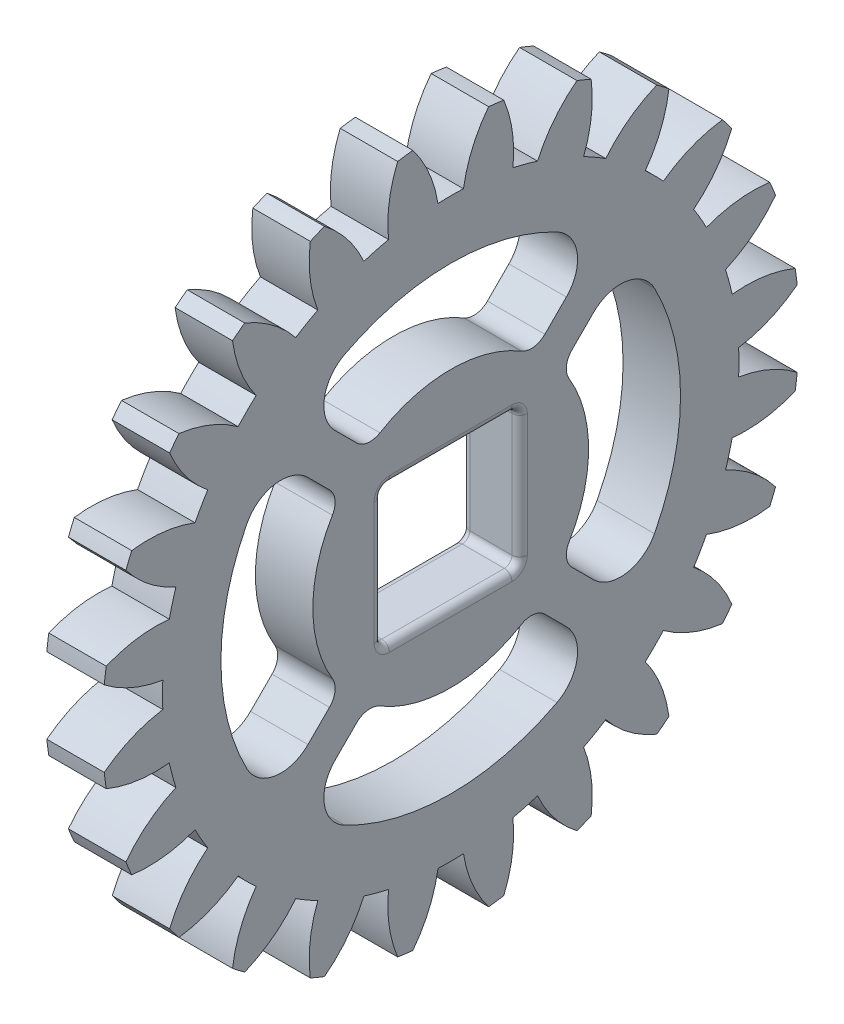
from build123d import *

# Parameters (mm, degrees)
BASPROSKE_W        = 15
BASPROSKE_H        = 91
TOOTHCUT_DEPTH     = 130.564655674
TEETHCUTS_COUNT    = 24
TEETHCUTS_ANGLE    = 345
BORSKE_R           = 12.5
BORE_DEPTH         = 50.0000508
SKETCH1_W          = 36
SKETCH1_H          = 36
CUT_EXTRUDE1_DEPTH = 129.807107813
FILLET1_R          = 2
CUT_EXTRUDE2_DEPTH = 129.807107813
FILLET2_R          = 5
FILLET3_R          = 10


with BuildPart() as part:
    # BasProSke → Base-Revolve (revolve)
    with BuildSketch(Plane(origin=(0, 0, 0), x_dir=(1, 0, 0), z_dir=(0, 1, 0)), mode=Mode.PRIVATE) as base_revolve_sk:
        with Locations((7.5, 45.5)):
            Rectangle(BASPROSKE_W, BASPROSKE_H)
    revolve(base_revolve_sk.sketch.rotate(Axis((-10, 0, 0), (1, 0, 0)), 180), axis=Axis((-10, 0, 0), (1, 0, 0)))

    # TooCutSke → ToothCut (cut, through all)
    with BuildSketch(Plane(origin=(0, 0, 0), x_dir=(0, 0, -1), z_dir=(1, 0, 0))):
        with BuildLine():
            ThreePointArc((3.330162782, 75.175275303), (0, 75.249), (-3.330162782, 75.175275303))
            ThreePointArc((-3.330162782, 75.175275303), (-5.65639011, 83.244180048), (-9.91079158, 90.48425087))
            ThreePointArc((-9.91079158, 90.48425087), (0, 91.0254), (9.91079158, 90.48425087))
            ThreePointArc((9.91079158, 90.48425087), (5.65639011, 83.244180048), (3.330162782, 75.175275303))
        make_face()
    toothcut = extrude(amount=TOOTHCUT_DEPTH, mode=Mode.SUBTRACT)

    # TeethCuts: ToothCut ×24 about axis
    teethcuts_axis = Axis((-10, 0, 0), (1, 0, 0))
    for i in range(1, TEETHCUTS_COUNT):
        add(toothcut.rotate(teethcuts_axis, i * TEETHCUTS_ANGLE / (TEETHCUTS_COUNT - 1)), mode=Mode.SUBTRACT)

    # BorSke → Bore (cut, symmetric)
    with BuildSketch(Plane(origin=(0, 0, 0), x_dir=(0, 0, -1), z_dir=(1, 0, 0))):
        with Locations(Location((0, 0, 0), (0, 0, 180))):
            Circle(BORSKE_R)
    extrude(amount=BORE_DEPTH, both=True, mode=Mode.SUBTRACT)

    # Sketch1 → Cut-Extrude1 (cut, through all)
    with BuildSketch(Plane(origin=(15, 0, 0), x_dir=(0, 0, -1), z_dir=(1, 0, 0))):
        Rectangle(SKETCH1_W, SKETCH1_H)
    extrude(amount=-CUT_EXTRUDE1_DEPTH, mode=Mode.SUBTRACT)

    # Fillet1
    fillet1_edges = [part.edges().sort_by_distance(p)[0] for p in [
        (0, 0, -18),
        (7.5, 18, -18),
        (0, -18, 0),
        (7.5, -18, -18),
        (0, 0, 18),
        (7.5, -18, 18),
        (0, 18, 0),
        (7.5, 18, 18),
        (15, 0, -18),
        (15, 18, 0),
        (15, 0, 18),
        (15, -18, 0),
    ]]
    fillet(fillet1_edges, radius=FILLET1_R)

    # Sketch2 → Cut-Extrude2 (cut, through all)
    with BuildSketch(Plane(origin=(15, 0, 0), x_dir=(0, 0, -1), z_dir=(1, 0, 0))):
        with BuildLine():
            Line((-38.743302407, 45.814370219), (-35.355339059, 42.426406871))
            Line((-35.355339059, 42.426406871), (35.355339059, 42.426406871))
            Line((35.355339059, 42.426406871), (38.743302407, 45.814370219))
            ThreePointArc((38.743302407, 45.814370219), (0, 60), (-38.743302407, 45.814370219))
        make_face()
        with BuildLine():
            Line((35.355339059, 42.426406871), (-35.355339059, 42.426406871))
            Line((-35.355339059, 42.426406871), (-21.673591426, 28.744659238))
            ThreePointArc((-21.673591426, 28.744659238), (0, 36), (21.673591426, 28.744659238))
            Line((21.673591426, 28.744659238), (35.355339059, 42.426406871))
        make_face()
        with BuildLine():
            Line((42.426406871, 35.355339059), (42.426406871, -35.355339059))
            Line((42.426406871, -35.355339059), (45.814370219, -38.743302407))
            ThreePointArc((45.814370219, -38.743302407), (56.342090009, -20.629321206), (60, 0))
            ThreePointArc((60, 0), (56.342090009, 20.629321206), (45.814370219, 38.743302407))
            Line((45.814370219, 38.743302407), (42.426406871, 35.355339059))
        make_face()
        with BuildLine():
            Line((28.744659238, -21.673591426), (42.426406871, -35.355339059))
            Line((42.426406871, -35.355339059), (42.426406871, 35.355339059))
            Line((42.426406871, 35.355339059), (28.744659238, 21.673591426))
            ThreePointArc((28.744659238, 21.673591426), (34.138012043, 11.427866543), (36, 0))
            ThreePointArc((36, 0), (34.138012043, -11.427866543), (28.744659238, -21.673591426))
        make_face()
        with BuildLine():
            Line((35.355339059, -42.426406871), (-35.355339059, -42.426406871))
            Line((-35.355339059, -42.426406871), (-38.743302407, -45.814370219))
            ThreePointArc((-38.743302407, -45.814370219), (0, -60), (38.743302407, -45.814370219))
            Line((38.743302407, -45.814370219), (35.355339059, -42.426406871))
        make_face()
        with BuildLine():
            Line((-21.673591426, -28.744659238), (-35.355339059, -42.426406871))
            Line((-35.355339059, -42.426406871), (35.355339059, -42.426406871))
            Line((35.355339059, -42.426406871), (21.673591426, -28.744659238))
            ThreePointArc((21.673591426, -28.744659238), (0, -36), (-21.673591426, -28.744659238))
        make_face()
        with BuildLine():
            Line((-45.814370219, -38.743302407), (-42.426406871, -35.355339059))
            Line((-42.426406871, -35.355339059), (-42.426406871, 35.355339059))
            Line((-42.426406871, 35.355339059), (-45.814370219, 38.743302407))
            ThreePointArc((-45.814370219, 38.743302407), (-60, 0), (-45.814370219, -38.743302407))
        make_face()
        with BuildLine():
            Line((-42.426406871, 35.355339059), (-42.426406871, -35.355339059))
            Line((-42.426406871, -35.355339059), (-28.744659238, -21.673591426))
            ThreePointArc((-28.744659238, -21.673591426), (-36, 0), (-28.744659238, 21.673591426))
            Line((-28.744659238, 21.673591426), (-42.426406871, 35.355339059))
        make_face()
    extrude(amount=-CUT_EXTRUDE2_DEPTH, mode=Mode.SUBTRACT)

    # Fillet2
    fillet2_edges = [part.edges().sort_by_distance(p)[0] for p in [
        (7.5, -28.744659238, 21.673591426),
        (7.5, -28.744659238, -21.673591426),
        (7.5, -21.673591426, -28.744659238),
        (7.5, 21.673591426, -28.744659238),
        (7.5, 21.673591426, 28.744659238),
        (7.5, -21.673591426, 28.744659238),
        (7.5, 28.744659238, -21.673591426),
        (7.5, 28.744659238, 21.673591426),
    ]]
    fillet(fillet2_edges, radius=FILLET2_R)

    # Fillet3
    fillet3_edges = [part.edges().sort_by_distance(p)[0] for p in [
        (7.5, -45.814370219, 38.743302407),
        (7.5, -45.814370219, -38.743302407),
        (7.5, -38.743302407, -45.814370219),
        (7.5, 38.743302407, -45.814370219),
        (7.5, 38.743302407, 45.814370219),
        (7.5, -38.743302407, 45.814370219),
        (7.5, 45.814370219, -38.743302407),
        (7.5, 45.814370219, 38.743302407),
    ]]
    fillet(fillet3_edges, radius=FILLET3_R)


solid = part.part
